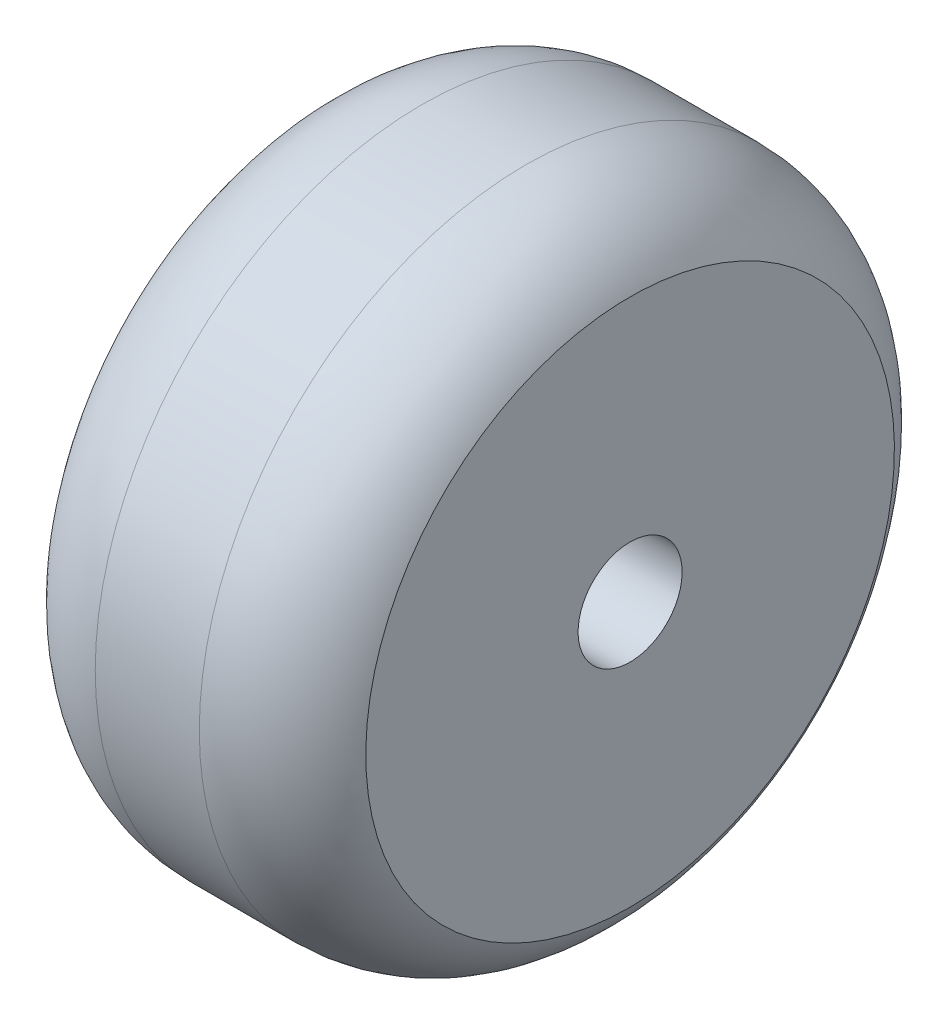
from build123d import *

# Parameters (mm, degrees)
SKETCH2_R          = 3.175
CUT_EXTRUDE1_DEPTH = 35.029838995


with BuildPart() as part:
    # Sketch1 → Revolve1 (revolve)
    with BuildSketch(Plane.XY):
        with BuildLine():
            Line((9.525, 0), (-9.525, 0))
            Line((-9.525, 0), (-9.525, -16.129))
            ThreePointArc((-9.525, -16.129), (-6.877654453, -18.913424089), (-3.175, -19.939))
            Line((-3.175, -19.939), (3.175, -19.939))
            ThreePointArc((3.175, -19.939), (6.877654453, -18.913424089), (9.525, -16.129))
            Line((9.525, -16.129), (9.525, 0))
        make_face()
    revolve(axis=Axis((-9.525, 0, 0), (1, 0, 0)))

    # Sketch2 → Cut-Extrude1 (cut, through all)
    with BuildSketch(Plane(origin=(9.525, 0, 0), x_dir=(0, 0, -1), z_dir=(1, 0, 0))):
        with Locations(Location((0, 0, 0), (0, 0, 90))):
            Circle(SKETCH2_R)
    extrude(amount=-CUT_EXTRUDE1_DEPTH, mode=Mode.SUBTRACT)


solid = part.part
